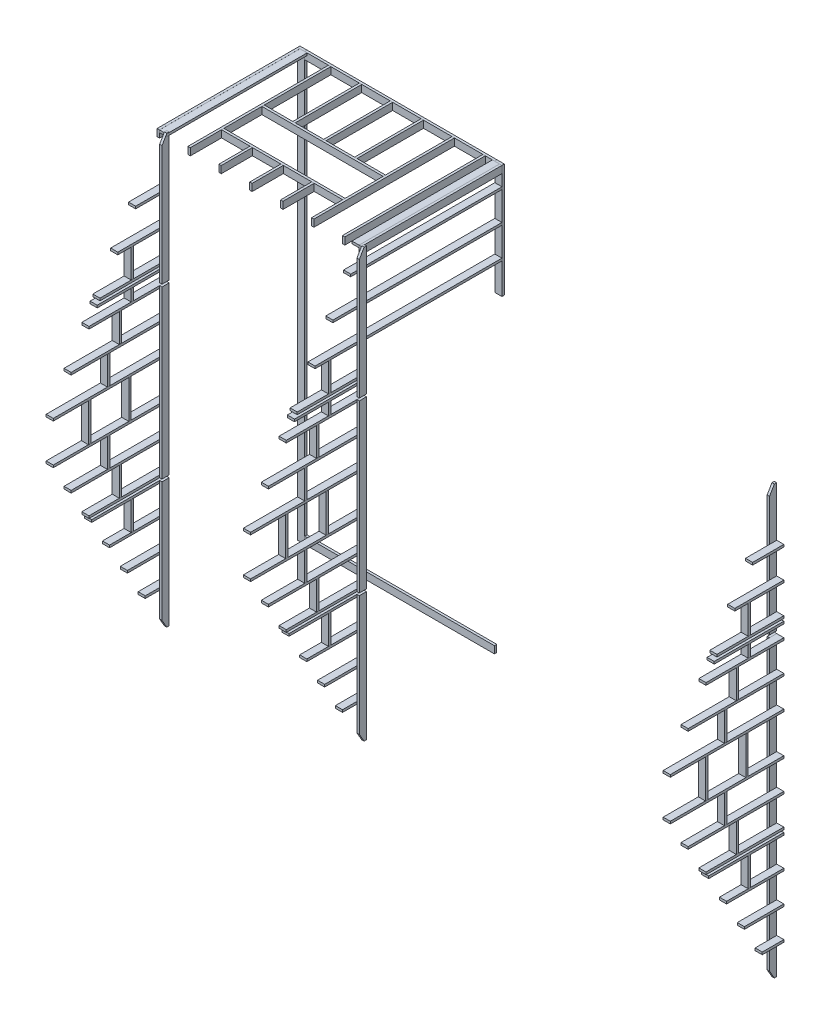
from build123d import *

# Parameters (mm, degrees)
EXTRUDE_1_DEPTH         = 50
EXTRUDE_1_DEPTH_BACK    = 100
SKETCH_2_W              = 1579.978213353
SKETCH_2_H              = 50
EXTRUDE_1_2_DEPTH       = 50
EXTRUDE_1_2_DEPTH_BACK  = 100
SKETCH_2_W_2            = 2388.268590218
EXTRUDE_1_3_DEPTH       = 50
EXTRUDE_1_3_DEPTH_BACK  = 100
EXTRUDE_1_4_DEPTH       = 50
EXTRUDE_1_4_DEPTH_BACK  = 100
SKETCH_2_W_3            = 50
SKETCH_2_H_2            = 798
EXTRUDE_1_5_DEPTH       = 50
EXTRUDE_1_5_DEPTH_BACK  = 100
EXTRUDE_1_6_DEPTH       = 50
EXTRUDE_1_6_DEPTH_BACK  = 100
SKETCH_2_W_4            = 2012.990915245
EXTRUDE_1_7_DEPTH       = 50
EXTRUDE_1_7_DEPTH_BACK  = 100
SKETCH_2_W_5            = 1637.713240271
EXTRUDE_1_8_DEPTH       = 50
EXTRUDE_1_8_DEPTH_BACK  = 100
SKETCH_2_W_6            = 1204.700538379
EXTRUDE_1_9_DEPTH       = 50
EXTRUDE_1_9_DEPTH_BACK  = 100
SKETCH_2_W_7            = 829.422863406
EXTRUDE_1_10_DEPTH      = 50
EXTRUDE_1_10_DEPTH_BACK = 100
SKETCH_2_W_8            = 454.145188433
EXTRUDE_1_11_DEPTH      = 50
EXTRUDE_1_11_DEPTH_BACK = 100
SKETCH_2_H_3            = 598
EXTRUDE_1_12_DEPTH      = 50
EXTRUDE_1_12_DEPTH_BACK = 100
EXTRUDE_1_13_DEPTH      = 50
EXTRUDE_1_13_DEPTH_BACK = 100
EXTRUDE_1_14_DEPTH      = 50
EXTRUDE_1_14_DEPTH_BACK = 100
EXTRUDE_1_15_DEPTH      = 50
EXTRUDE_1_15_DEPTH_BACK = 100
EXTRUDE_1_16_DEPTH      = 50
EXTRUDE_1_16_DEPTH_BACK = 100
EXTRUDE_1_17_DEPTH      = 50
EXTRUDE_1_17_DEPTH_BACK = 100
EXTRUDE_1_18_DEPTH      = 50
EXTRUDE_1_18_DEPTH_BACK = 100
SKETCH_2_W_9            = 1464.508159515
EXTRUDE_1_19_DEPTH      = 50
EXTRUDE_1_19_DEPTH_BACK = 100
SKETCH_2_W_10           = 1406.773132596
EXTRUDE_1_20_DEPTH      = 50
EXTRUDE_1_20_DEPTH_BACK = 100
SKETCH_2_W_11           = 1031.495457622
EXTRUDE_1_21_DEPTH      = 50
EXTRUDE_1_21_DEPTH_BACK = 100
SKETCH_2_H_4            = 248
EXTRUDE_1_22_DEPTH      = 50
EXTRUDE_1_22_DEPTH_BACK = 100
EXTRUDE_1_23_DEPTH      = 50
EXTRUDE_1_23_DEPTH_BACK = 100
SKETCH_2_W_12           = 656.217782649
EXTRUDE_START           = 8880
SKETCH_2_2_W            = 1579.978213353
SKETCH_2_2_H            = 50
EXTRUDE_2_DEPTH         = 150
SKETCH_2_2_W_2          = 2388.268590218
EXTRUDE_2_2_DEPTH       = 150
EXTRUDE_2_3_DEPTH       = 150
SKETCH_2_2_W_3          = 50
SKETCH_2_2_H_2          = 798
EXTRUDE_2_4_DEPTH       = 150
EXTRUDE_2_5_DEPTH       = 150
SKETCH_2_2_W_4          = 2012.990915245
EXTRUDE_2_6_DEPTH       = 150
SKETCH_2_2_W_5          = 1637.713240271
EXTRUDE_2_7_DEPTH       = 150
SKETCH_2_2_W_6          = 1204.700538379
EXTRUDE_2_8_DEPTH       = 150
SKETCH_2_2_W_7          = 829.422863406
EXTRUDE_2_9_DEPTH       = 150
SKETCH_2_2_W_8          = 454.145188433
EXTRUDE_2_10_DEPTH      = 150
SKETCH_2_2_H_3          = 598
EXTRUDE_2_11_DEPTH      = 150
EXTRUDE_2_12_DEPTH      = 150
EXTRUDE_2_13_DEPTH      = 150
EXTRUDE_2_14_DEPTH      = 150
EXTRUDE_2_15_DEPTH      = 150
EXTRUDE_2_16_DEPTH      = 150
EXTRUDE_2_17_DEPTH      = 150
SKETCH_2_2_W_9          = 1464.508159515
EXTRUDE_2_18_DEPTH      = 150
SKETCH_2_2_W_10         = 1406.773132596
EXTRUDE_2_19_DEPTH      = 150
SKETCH_2_2_W_11         = 1031.495457622
EXTRUDE_2_20_DEPTH      = 150
SKETCH_2_2_H_4          = 248
EXTRUDE_2_21_DEPTH      = 150
EXTRUDE_2_22_DEPTH      = 150
SKETCH_2_2_W_12         = 656.217782649
EXTRUDE_2_23_DEPTH      = 150
EXTRUDE_START_2         = 13030
SKETCH_2_3_W            = 1579.978213353
SKETCH_2_3_H            = 50
EXTRUDE_3_DEPTH         = 150
SKETCH_2_3_W_2          = 2388.268590218
EXTRUDE_3_2_DEPTH       = 150
EXTRUDE_3_3_DEPTH       = 150
SKETCH_2_3_W_3          = 50
SKETCH_2_3_H_2          = 798
EXTRUDE_3_4_DEPTH       = 150
EXTRUDE_3_5_DEPTH       = 150
SKETCH_2_3_W_4          = 2012.990915245
EXTRUDE_3_6_DEPTH       = 150
SKETCH_2_3_W_5          = 1637.713240271
EXTRUDE_3_7_DEPTH       = 150
SKETCH_2_3_W_6          = 1204.700538379
EXTRUDE_3_8_DEPTH       = 150
SKETCH_2_3_W_7          = 829.422863406
EXTRUDE_3_9_DEPTH       = 150
SKETCH_2_3_W_8          = 454.145188433
EXTRUDE_3_10_DEPTH      = 150
SKETCH_2_3_H_3          = 598
EXTRUDE_3_11_DEPTH      = 150
EXTRUDE_3_12_DEPTH      = 150
EXTRUDE_3_13_DEPTH      = 150
EXTRUDE_3_14_DEPTH      = 150
EXTRUDE_3_15_DEPTH      = 150
EXTRUDE_3_16_DEPTH      = 150
EXTRUDE_3_17_DEPTH      = 150
SKETCH_2_3_W_9          = 1464.508159515
EXTRUDE_3_18_DEPTH      = 150
SKETCH_2_3_W_10         = 1406.773132596
EXTRUDE_3_19_DEPTH      = 150
SKETCH_2_3_W_11         = 1031.495457622
EXTRUDE_3_20_DEPTH      = 150
SKETCH_2_3_H_4          = 248
EXTRUDE_3_21_DEPTH      = 150
EXTRUDE_3_22_DEPTH      = 150
SKETCH_2_3_W_12         = 656.217782649
EXTRUDE_3_23_DEPTH      = 150
EXTRUDE_4_DEPTH         = 50
SKETCH_3_W              = 150
SKETCH_3_H              = 3500
EXTRUDE_4_2_DEPTH       = 50
EXTRUDE_4_3_DEPTH       = 50
EXTRUDE_START_3         = 8680
EXTRUDE_5_DEPTH         = 50
SKETCH_3_2_W            = 150
SKETCH_3_2_H            = 3500
EXTRUDE_5_2_DEPTH       = 50
EXTRUDE_5_3_DEPTH       = 50
EXTRUDE_START_4         = 12830
EXTRUDE_6_DEPTH         = 50
SKETCH_3_3_W            = 150
SKETCH_3_3_H            = 3500
EXTRUDE_6_2_DEPTH       = 50
EXTRUDE_6_3_DEPTH       = 50
SKETCH_4_W              = 150
SKETCH_4_H              = 2390
EXTRUDE_7_DEPTH         = 50
SKETCH_4_H_2            = 8980
EXTRUDE_7_2_DEPTH       = 50
SKETCH_4_W_2            = 3998
SKETCH_4_H_3            = 150
EXTRUDE_7_3_DEPTH       = 50
SKETCH_4_W_3            = 3989
EXTRUDE_7_4_DEPTH       = 50
SKETCH_5_W              = 2900
SKETCH_5_H              = 50
EXTRUDE_8_DEPTH         = 150
EXTRUDE_8_2_DEPTH       = 150
SKETCH_5_W_2            = 3180.940107676
EXTRUDE_8_3_DEPTH       = 150
SKETCH_6_W              = 2955.773502692
SKETCH_6_H              = 150
EXTRUDE_9_DEPTH         = 50
SKETCH_7_W              = 50
SKETCH_7_H              = 150
EXTRUDE_10_DEPTH        = 2955.773502692
SKETCH_7_W_2            = 150
SKETCH_7_H_2            = 50
EXTRUDE_10_2_DEPTH      = 2955.773502692
EXTRUDE_10_3_DEPTH      = 2955.773502692
EXTRUDE_10_4_DEPTH      = 2955.773502692
EXTRUDE_10_5_DEPTH      = 2955.773502692
EXTRUDE_10_6_DEPTH      = 2955.773502692
EXTRUDE_10_7_DEPTH      = 2955.773502692
EXTRUDE_10_8_DEPTH      = 2955.773502692
EXTRUDE_10_9_DEPTH      = 2955.773502692
SKETCH_8_W              = 2550
SKETCH_8_H              = 900
CUT_EXTRUDE_1_DEPTH     = 488
SKETCH_9_W              = 2550
SKETCH_9_H              = 50
EXTRUDE_11_DEPTH        = 150
EXTRUDE_11_2_DEPTH      = 150


with BuildPart() as part:
    # Эскиз2 → Бобышка-Вытянуть1 (new, two sides: drawn at the far end of the back side and taken through both)
    with BuildSketch(Plane.ZY.offset(110).offset(-EXTRUDE_1_DEPTH_BACK)):
        with Locations((739.989106677, 2675)):
            Rectangle(SKETCH_2_W, SKETCH_2_H)
    extrude(amount=EXTRUDE_1_DEPTH + EXTRUDE_1_DEPTH_BACK)


with BuildPart() as body_2:
    # Эскиз2 → Extrude 1 2 (new, two sides: drawn at the far end of the back side and taken through both)
    with BuildSketch(Plane.ZY.offset(110).offset(-EXTRUDE_1_2_DEPTH_BACK)):
        with Locations((1144.134295109, 4075)):
            Rectangle(SKETCH_2_W_2, SKETCH_2_H)
    extrude(amount=EXTRUDE_1_2_DEPTH + EXTRUDE_1_2_DEPTH_BACK)


with BuildPart() as body_3:
    # Эскиз2 → Extrude 1 3 (new, two sides: drawn at the far end of the back side and taken through both)
    with BuildSketch(Plane.ZY.offset(110).offset(-EXTRUDE_1_3_DEPTH_BACK)):
        with Locations((1144.134295109, 4925)):
            Rectangle(SKETCH_2_W_2, SKETCH_2_H)
    extrude(amount=EXTRUDE_1_3_DEPTH + EXTRUDE_1_3_DEPTH_BACK)


with BuildPart() as body_4:
    # Эскиз2 → Extrude 1 4 (new, two sides: drawn at the far end of the back side and taken through both)
    with BuildSketch(Plane.ZY.offset(110).offset(-EXTRUDE_1_4_DEPTH_BACK)):
        with Locations((1575, 4500)):
            Rectangle(SKETCH_2_W_3, SKETCH_2_H_2)
    extrude(amount=EXTRUDE_1_4_DEPTH + EXTRUDE_1_4_DEPTH_BACK)


with BuildPart() as body_5:
    # Эскиз2 → Extrude 1 5 (new, two sides: drawn at the far end of the back side and taken through both)
    with BuildSketch(Plane.ZY.offset(110).offset(-EXTRUDE_1_5_DEPTH_BACK)):
        with Locations((725, 4500)):
            Rectangle(SKETCH_2_W_3, SKETCH_2_H_2)
    extrude(amount=EXTRUDE_1_5_DEPTH + EXTRUDE_1_5_DEPTH_BACK)


with BuildPart() as body_6:
    # Эскиз2 → Extrude 1 6 (new, two sides: drawn at the far end of the back side and taken through both)
    with BuildSketch(Plane.ZY.offset(110).offset(-EXTRUDE_1_6_DEPTH_BACK)):
        with Locations((956.495457623, 3425)):
            Rectangle(SKETCH_2_W_4, SKETCH_2_H)
    extrude(amount=EXTRUDE_1_6_DEPTH + EXTRUDE_1_6_DEPTH_BACK)


with BuildPart() as body_7:
    # Эскиз2 → Extrude 1 7 (new, two sides: drawn at the far end of the back side and taken through both)
    with BuildSketch(Plane.ZY.offset(110).offset(-EXTRUDE_1_7_DEPTH_BACK)):
        with Locations((768.856620136, 2775)):
            Rectangle(SKETCH_2_W_5, SKETCH_2_H)
    extrude(amount=EXTRUDE_1_7_DEPTH + EXTRUDE_1_7_DEPTH_BACK)


with BuildPart() as body_8:
    # Эскиз2 → Extrude 1 8 (new, two sides: drawn at the far end of the back side and taken through both)
    with BuildSketch(Plane.ZY.offset(110).offset(-EXTRUDE_1_8_DEPTH_BACK)):
        with Locations((552.35026919, 2025)):
            Rectangle(SKETCH_2_W_6, SKETCH_2_H)
    extrude(amount=EXTRUDE_1_8_DEPTH + EXTRUDE_1_8_DEPTH_BACK)


with BuildPart() as body_9:
    # Эскиз2 → Extrude 1 9 (new, two sides: drawn at the far end of the back side and taken through both)
    with BuildSketch(Plane.ZY.offset(110).offset(-EXTRUDE_1_9_DEPTH_BACK)):
        with Locations((364.711431703, 1375)):
            Rectangle(SKETCH_2_W_7, SKETCH_2_H)
    extrude(amount=EXTRUDE_1_9_DEPTH + EXTRUDE_1_9_DEPTH_BACK)


with BuildPart() as body_10:
    # Эскиз2 → Extrude 1 10 (new, two sides: drawn at the far end of the back side and taken through both)
    with BuildSketch(Plane.ZY.offset(110).offset(-EXTRUDE_1_10_DEPTH_BACK)):
        with Locations((177.072594217, 725)):
            Rectangle(SKETCH_2_W_8, SKETCH_2_H)
    extrude(amount=EXTRUDE_1_10_DEPTH + EXTRUDE_1_10_DEPTH_BACK)


with BuildPart() as body_11:
    # Эскиз2 → Extrude 1 11 (new, two sides: drawn at the far end of the back side and taken through both)
    with BuildSketch(Plane.ZY.offset(110).offset(-EXTRUDE_1_11_DEPTH_BACK)):
        with Locations((1175, 3750)):
            Rectangle(SKETCH_2_W_3, SKETCH_2_H_3)
    extrude(amount=EXTRUDE_1_11_DEPTH + EXTRUDE_1_11_DEPTH_BACK)


with BuildPart() as body_12:
    # Эскиз2 → Extrude 1 12 (new, two sides: drawn at the far end of the back side and taken through both)
    with BuildSketch(Plane.ZY.offset(110).offset(-EXTRUDE_1_12_DEPTH_BACK)):
        with Locations((925, 3100)):
            Rectangle(SKETCH_2_W_3, SKETCH_2_H_3)
    extrude(amount=EXTRUDE_1_12_DEPTH + EXTRUDE_1_12_DEPTH_BACK)


with BuildPart() as body_13:
    # Эскиз2 → Extrude 1 13 (new, two sides: drawn at the far end of the back side and taken through both)
    with BuildSketch(Plane.ZY.offset(110).offset(-EXTRUDE_1_13_DEPTH_BACK)):
        with Locations((675, 2350)):
            Rectangle(SKETCH_2_W_3, SKETCH_2_H_3)
    extrude(amount=EXTRUDE_1_13_DEPTH + EXTRUDE_1_13_DEPTH_BACK)


with BuildPart() as body_14:
    # Эскиз2 → Extrude 1 14 (new, two sides: drawn at the far end of the back side and taken through both)
    with BuildSketch(Plane.ZY.offset(110).offset(-EXTRUDE_1_14_DEPTH_BACK)):
        with Locations((1175, 5250)):
            Rectangle(SKETCH_2_W_3, SKETCH_2_H_3)
    extrude(amount=EXTRUDE_1_14_DEPTH + EXTRUDE_1_14_DEPTH_BACK)


with BuildPart() as body_15:
    # Эскиз2 → Extrude 1 15 (new, two sides: drawn at the far end of the back side and taken through both)
    with BuildSketch(Plane.ZY.offset(110).offset(-EXTRUDE_1_15_DEPTH_BACK)):
        with Locations((925, 5900)):
            Rectangle(SKETCH_2_W_3, SKETCH_2_H_3)
    extrude(amount=EXTRUDE_1_15_DEPTH + EXTRUDE_1_15_DEPTH_BACK)


with BuildPart() as body_16:
    # Эскиз2 → Extrude 1 16 (new, two sides: drawn at the far end of the back side and taken through both)
    with BuildSketch(Plane.ZY.offset(110).offset(-EXTRUDE_1_16_DEPTH_BACK)):
        with Locations((768.856620136, 6225)):
            Rectangle(SKETCH_2_W_5, SKETCH_2_H)
    extrude(amount=EXTRUDE_1_16_DEPTH + EXTRUDE_1_16_DEPTH_BACK)


with BuildPart() as body_17:
    # Эскиз2 → Extrude 1 17 (new, two sides: drawn at the far end of the back side and taken through both)
    with BuildSketch(Plane.ZY.offset(110).offset(-EXTRUDE_1_17_DEPTH_BACK)):
        with Locations((956.495457623, 5575)):
            Rectangle(SKETCH_2_W_4, SKETCH_2_H)
    extrude(amount=EXTRUDE_1_17_DEPTH + EXTRUDE_1_17_DEPTH_BACK)


with BuildPart() as body_18:
    # Эскиз2 → Extrude 1 18 (new, two sides: drawn at the far end of the back side and taken through both)
    with BuildSketch(Plane.ZY.offset(110).offset(-EXTRUDE_1_18_DEPTH_BACK)):
        with Locations((682.254079757, 6525)):
            Rectangle(SKETCH_2_W_9, SKETCH_2_H)
    extrude(amount=EXTRUDE_1_18_DEPTH + EXTRUDE_1_18_DEPTH_BACK)


with BuildPart() as body_19:
    # Эскиз2 → Extrude 1 19 (new, two sides: drawn at the far end of the back side and taken through both)
    with BuildSketch(Plane.ZY.offset(110).offset(-EXTRUDE_1_19_DEPTH_BACK)):
        with Locations((653.386566298, 6625)):
            Rectangle(SKETCH_2_W_10, SKETCH_2_H)
    extrude(amount=EXTRUDE_1_19_DEPTH + EXTRUDE_1_19_DEPTH_BACK)


with BuildPart() as body_20:
    # Эскиз2 → Extrude 1 20 (new, two sides: drawn at the far end of the back side and taken through both)
    with BuildSketch(Plane.ZY.offset(110).offset(-EXTRUDE_1_20_DEPTH_BACK)):
        with Locations((465.747728811, 7275)):
            Rectangle(SKETCH_2_W_11, SKETCH_2_H)
    extrude(amount=EXTRUDE_1_20_DEPTH + EXTRUDE_1_20_DEPTH_BACK)


with BuildPart() as body_21:
    # Эскиз2 → Extrude 1 21 (new, two sides: drawn at the far end of the back side and taken through both)
    with BuildSketch(Plane.ZY.offset(110).offset(-EXTRUDE_1_21_DEPTH_BACK)):
        with Locations((675, 6375)):
            Rectangle(SKETCH_2_W_3, SKETCH_2_H_4)
    extrude(amount=EXTRUDE_1_21_DEPTH + EXTRUDE_1_21_DEPTH_BACK)


with BuildPart() as body_22:
    # Эскиз2 → Extrude 1 22 (new, two sides: drawn at the far end of the back side and taken through both)
    with BuildSketch(Plane.ZY.offset(110).offset(-EXTRUDE_1_22_DEPTH_BACK)):
        with Locations((675, 6950)):
            Rectangle(SKETCH_2_W_3, SKETCH_2_H_3)
    extrude(amount=EXTRUDE_1_22_DEPTH + EXTRUDE_1_22_DEPTH_BACK)


with BuildPart() as body_23:
    # Эскиз2 → Extrude 1 23 (new, two sides: drawn at the far end of the back side and taken through both)
    with BuildSketch(Plane.ZY.offset(110).offset(-EXTRUDE_1_23_DEPTH_BACK)):
        with Locations((278.108891325, 7925)):
            Rectangle(SKETCH_2_W_12, SKETCH_2_H)
    extrude(amount=EXTRUDE_1_23_DEPTH + EXTRUDE_1_23_DEPTH_BACK)


with BuildPart() as body_24:
    # Эскиз2<2> → Бобышка-Вытянуть2 (new body)
    with BuildSketch(Plane.ZY.offset(110).offset(EXTRUDE_START)):
        with Locations((739.989106677, 2675)):
            Rectangle(SKETCH_2_2_W, SKETCH_2_2_H)
    extrude(amount=-EXTRUDE_2_DEPTH)


with BuildPart() as body_25:
    # Эскиз2<2> → Extrude 2 2 (new body)
    with BuildSketch(Plane.ZY.offset(110).offset(EXTRUDE_START)):
        with Locations((1144.134295109, 4075)):
            Rectangle(SKETCH_2_2_W_2, SKETCH_2_2_H)
    extrude(amount=-EXTRUDE_2_2_DEPTH)


with BuildPart() as body_26:
    # Эскиз2<2> → Extrude 2 3 (new body)
    with BuildSketch(Plane.ZY.offset(110).offset(EXTRUDE_START)):
        with Locations((1144.134295109, 4925)):
            Rectangle(SKETCH_2_2_W_2, SKETCH_2_2_H)
    extrude(amount=-EXTRUDE_2_3_DEPTH)


with BuildPart() as body_27:
    # Эскиз2<2> → Extrude 2 4 (new body)
    with BuildSketch(Plane.ZY.offset(110).offset(EXTRUDE_START)):
        with Locations((1575, 4500)):
            Rectangle(SKETCH_2_2_W_3, SKETCH_2_2_H_2)
    extrude(amount=-EXTRUDE_2_4_DEPTH)


with BuildPart() as body_28:
    # Эскиз2<2> → Extrude 2 5 (new body)
    with BuildSketch(Plane.ZY.offset(110).offset(EXTRUDE_START)):
        with Locations((725, 4500)):
            Rectangle(SKETCH_2_2_W_3, SKETCH_2_2_H_2)
    extrude(amount=-EXTRUDE_2_5_DEPTH)


with BuildPart() as body_29:
    # Эскиз2<2> → Extrude 2 6 (new body)
    with BuildSketch(Plane.ZY.offset(110).offset(EXTRUDE_START)):
        with Locations((956.495457623, 3425)):
            Rectangle(SKETCH_2_2_W_4, SKETCH_2_2_H)
    extrude(amount=-EXTRUDE_2_6_DEPTH)


with BuildPart() as body_30:
    # Эскиз2<2> → Extrude 2 7 (new body)
    with BuildSketch(Plane.ZY.offset(110).offset(EXTRUDE_START)):
        with Locations((768.856620136, 2775)):
            Rectangle(SKETCH_2_2_W_5, SKETCH_2_2_H)
    extrude(amount=-EXTRUDE_2_7_DEPTH)


with BuildPart() as body_31:
    # Эскиз2<2> → Extrude 2 8 (new body)
    with BuildSketch(Plane.ZY.offset(110).offset(EXTRUDE_START)):
        with Locations((552.35026919, 2025)):
            Rectangle(SKETCH_2_2_W_6, SKETCH_2_2_H)
    extrude(amount=-EXTRUDE_2_8_DEPTH)


with BuildPart() as body_32:
    # Эскиз2<2> → Extrude 2 9 (new body)
    with BuildSketch(Plane.ZY.offset(110).offset(EXTRUDE_START)):
        with Locations((364.711431703, 1375)):
            Rectangle(SKETCH_2_2_W_7, SKETCH_2_2_H)
    extrude(amount=-EXTRUDE_2_9_DEPTH)


with BuildPart() as body_33:
    # Эскиз2<2> → Extrude 2 10 (new body)
    with BuildSketch(Plane.ZY.offset(110).offset(EXTRUDE_START)):
        with Locations((177.072594217, 725)):
            Rectangle(SKETCH_2_2_W_8, SKETCH_2_2_H)
    extrude(amount=-EXTRUDE_2_10_DEPTH)


with BuildPart() as body_34:
    # Эскиз2<2> → Extrude 2 11 (new body)
    with BuildSketch(Plane.ZY.offset(110).offset(EXTRUDE_START)):
        with Locations((1175, 3750)):
            Rectangle(SKETCH_2_2_W_3, SKETCH_2_2_H_3)
    extrude(amount=-EXTRUDE_2_11_DEPTH)


with BuildPart() as body_35:
    # Эскиз2<2> → Extrude 2 12 (new body)
    with BuildSketch(Plane.ZY.offset(110).offset(EXTRUDE_START)):
        with Locations((925, 3100)):
            Rectangle(SKETCH_2_2_W_3, SKETCH_2_2_H_3)
    extrude(amount=-EXTRUDE_2_12_DEPTH)


with BuildPart() as body_36:
    # Эскиз2<2> → Extrude 2 13 (new body)
    with BuildSketch(Plane.ZY.offset(110).offset(EXTRUDE_START)):
        with Locations((675, 2350)):
            Rectangle(SKETCH_2_2_W_3, SKETCH_2_2_H_3)
    extrude(amount=-EXTRUDE_2_13_DEPTH)


with BuildPart() as body_37:
    # Эскиз2<2> → Extrude 2 14 (new body)
    with BuildSketch(Plane.ZY.offset(110).offset(EXTRUDE_START)):
        with Locations((1175, 5250)):
            Rectangle(SKETCH_2_2_W_3, SKETCH_2_2_H_3)
    extrude(amount=-EXTRUDE_2_14_DEPTH)


with BuildPart() as body_38:
    # Эскиз2<2> → Extrude 2 15 (new body)
    with BuildSketch(Plane.ZY.offset(110).offset(EXTRUDE_START)):
        with Locations((925, 5900)):
            Rectangle(SKETCH_2_2_W_3, SKETCH_2_2_H_3)
    extrude(amount=-EXTRUDE_2_15_DEPTH)


with BuildPart() as body_39:
    # Эскиз2<2> → Extrude 2 16 (new body)
    with BuildSketch(Plane.ZY.offset(110).offset(EXTRUDE_START)):
        with Locations((768.856620136, 6225)):
            Rectangle(SKETCH_2_2_W_5, SKETCH_2_2_H)
    extrude(amount=-EXTRUDE_2_16_DEPTH)


with BuildPart() as body_40:
    # Эскиз2<2> → Extrude 2 17 (new body)
    with BuildSketch(Plane.ZY.offset(110).offset(EXTRUDE_START)):
        with Locations((956.495457623, 5575)):
            Rectangle(SKETCH_2_2_W_4, SKETCH_2_2_H)
    extrude(amount=-EXTRUDE_2_17_DEPTH)


with BuildPart() as body_41:
    # Эскиз2<2> → Extrude 2 18 (new body)
    with BuildSketch(Plane.ZY.offset(110).offset(EXTRUDE_START)):
        with Locations((682.254079757, 6525)):
            Rectangle(SKETCH_2_2_W_9, SKETCH_2_2_H)
    extrude(amount=-EXTRUDE_2_18_DEPTH)


with BuildPart() as body_42:
    # Эскиз2<2> → Extrude 2 19 (new body)
    with BuildSketch(Plane.ZY.offset(110).offset(EXTRUDE_START)):
        with Locations((653.386566298, 6625)):
            Rectangle(SKETCH_2_2_W_10, SKETCH_2_2_H)
    extrude(amount=-EXTRUDE_2_19_DEPTH)


with BuildPart() as body_43:
    # Эскиз2<2> → Extrude 2 20 (new body)
    with BuildSketch(Plane.ZY.offset(110).offset(EXTRUDE_START)):
        with Locations((465.747728811, 7275)):
            Rectangle(SKETCH_2_2_W_11, SKETCH_2_2_H)
    extrude(amount=-EXTRUDE_2_20_DEPTH)


with BuildPart() as body_44:
    # Эскиз2<2> → Extrude 2 21 (new body)
    with BuildSketch(Plane.ZY.offset(110).offset(EXTRUDE_START)):
        with Locations((675, 6375)):
            Rectangle(SKETCH_2_2_W_3, SKETCH_2_2_H_4)
    extrude(amount=-EXTRUDE_2_21_DEPTH)


with BuildPart() as body_45:
    # Эскиз2<2> → Extrude 2 22 (new body)
    with BuildSketch(Plane.ZY.offset(110).offset(EXTRUDE_START)):
        with Locations((675, 6950)):
            Rectangle(SKETCH_2_2_W_3, SKETCH_2_2_H_3)
    extrude(amount=-EXTRUDE_2_22_DEPTH)


with BuildPart() as body_46:
    # Эскиз2<2> → Extrude 2 23 (new body)
    with BuildSketch(Plane.ZY.offset(110).offset(EXTRUDE_START)):
        with Locations((278.108891325, 7925)):
            Rectangle(SKETCH_2_2_W_12, SKETCH_2_2_H)
    extrude(amount=-EXTRUDE_2_23_DEPTH)


with BuildPart() as body_47:
    # Эскиз2<3> → Бобышка-Вытянуть3 (new body)
    with BuildSketch(Plane.ZY.offset(110).offset(EXTRUDE_START_2)):
        with Locations((739.989106677, 2675)):
            Rectangle(SKETCH_2_3_W, SKETCH_2_3_H)
    extrude(amount=-EXTRUDE_3_DEPTH)


with BuildPart() as body_48:
    # Эскиз2<3> → Extrude 3 2 (new body)
    with BuildSketch(Plane.ZY.offset(110).offset(EXTRUDE_START_2)):
        with Locations((1144.134295109, 4075)):
            Rectangle(SKETCH_2_3_W_2, SKETCH_2_3_H)
    extrude(amount=-EXTRUDE_3_2_DEPTH)


with BuildPart() as body_49:
    # Эскиз2<3> → Extrude 3 3 (new body)
    with BuildSketch(Plane.ZY.offset(110).offset(EXTRUDE_START_2)):
        with Locations((1144.134295109, 4925)):
            Rectangle(SKETCH_2_3_W_2, SKETCH_2_3_H)
    extrude(amount=-EXTRUDE_3_3_DEPTH)


with BuildPart() as body_50:
    # Эскиз2<3> → Extrude 3 4 (new body)
    with BuildSketch(Plane.ZY.offset(110).offset(EXTRUDE_START_2)):
        with Locations((1575, 4500)):
            Rectangle(SKETCH_2_3_W_3, SKETCH_2_3_H_2)
    extrude(amount=-EXTRUDE_3_4_DEPTH)


with BuildPart() as body_51:
    # Эскиз2<3> → Extrude 3 5 (new body)
    with BuildSketch(Plane.ZY.offset(110).offset(EXTRUDE_START_2)):
        with Locations((725, 4500)):
            Rectangle(SKETCH_2_3_W_3, SKETCH_2_3_H_2)
    extrude(amount=-EXTRUDE_3_5_DEPTH)


with BuildPart() as body_52:
    # Эскиз2<3> → Extrude 3 6 (new body)
    with BuildSketch(Plane.ZY.offset(110).offset(EXTRUDE_START_2)):
        with Locations((956.495457623, 3425)):
            Rectangle(SKETCH_2_3_W_4, SKETCH_2_3_H)
    extrude(amount=-EXTRUDE_3_6_DEPTH)


with BuildPart() as body_53:
    # Эскиз2<3> → Extrude 3 7 (new body)
    with BuildSketch(Plane.ZY.offset(110).offset(EXTRUDE_START_2)):
        with Locations((768.856620136, 2775)):
            Rectangle(SKETCH_2_3_W_5, SKETCH_2_3_H)
    extrude(amount=-EXTRUDE_3_7_DEPTH)


with BuildPart() as body_54:
    # Эскиз2<3> → Extrude 3 8 (new body)
    with BuildSketch(Plane.ZY.offset(110).offset(EXTRUDE_START_2)):
        with Locations((552.35026919, 2025)):
            Rectangle(SKETCH_2_3_W_6, SKETCH_2_3_H)
    extrude(amount=-EXTRUDE_3_8_DEPTH)


with BuildPart() as body_55:
    # Эскиз2<3> → Extrude 3 9 (new body)
    with BuildSketch(Plane.ZY.offset(110).offset(EXTRUDE_START_2)):
        with Locations((364.711431703, 1375)):
            Rectangle(SKETCH_2_3_W_7, SKETCH_2_3_H)
    extrude(amount=-EXTRUDE_3_9_DEPTH)


with BuildPart() as body_56:
    # Эскиз2<3> → Extrude 3 10 (new body)
    with BuildSketch(Plane.ZY.offset(110).offset(EXTRUDE_START_2)):
        with Locations((177.072594217, 725)):
            Rectangle(SKETCH_2_3_W_8, SKETCH_2_3_H)
    extrude(amount=-EXTRUDE_3_10_DEPTH)


with BuildPart() as body_57:
    # Эскиз2<3> → Extrude 3 11 (new body)
    with BuildSketch(Plane.ZY.offset(110).offset(EXTRUDE_START_2)):
        with Locations((1175, 3750)):
            Rectangle(SKETCH_2_3_W_3, SKETCH_2_3_H_3)
    extrude(amount=-EXTRUDE_3_11_DEPTH)


with BuildPart() as body_58:
    # Эскиз2<3> → Extrude 3 12 (new body)
    with BuildSketch(Plane.ZY.offset(110).offset(EXTRUDE_START_2)):
        with Locations((925, 3100)):
            Rectangle(SKETCH_2_3_W_3, SKETCH_2_3_H_3)
    extrude(amount=-EXTRUDE_3_12_DEPTH)


with BuildPart() as body_59:
    # Эскиз2<3> → Extrude 3 13 (new body)
    with BuildSketch(Plane.ZY.offset(110).offset(EXTRUDE_START_2)):
        with Locations((675, 2350)):
            Rectangle(SKETCH_2_3_W_3, SKETCH_2_3_H_3)
    extrude(amount=-EXTRUDE_3_13_DEPTH)


with BuildPart() as body_60:
    # Эскиз2<3> → Extrude 3 14 (new body)
    with BuildSketch(Plane.ZY.offset(110).offset(EXTRUDE_START_2)):
        with Locations((1175, 5250)):
            Rectangle(SKETCH_2_3_W_3, SKETCH_2_3_H_3)
    extrude(amount=-EXTRUDE_3_14_DEPTH)


with BuildPart() as body_61:
    # Эскиз2<3> → Extrude 3 15 (new body)
    with BuildSketch(Plane.ZY.offset(110).offset(EXTRUDE_START_2)):
        with Locations((925, 5900)):
            Rectangle(SKETCH_2_3_W_3, SKETCH_2_3_H_3)
    extrude(amount=-EXTRUDE_3_15_DEPTH)


with BuildPart() as body_62:
    # Эскиз2<3> → Extrude 3 16 (new body)
    with BuildSketch(Plane.ZY.offset(110).offset(EXTRUDE_START_2)):
        with Locations((768.856620136, 6225)):
            Rectangle(SKETCH_2_3_W_5, SKETCH_2_3_H)
    extrude(amount=-EXTRUDE_3_16_DEPTH)


with BuildPart() as body_63:
    # Эскиз2<3> → Extrude 3 17 (new body)
    with BuildSketch(Plane.ZY.offset(110).offset(EXTRUDE_START_2)):
        with Locations((956.495457623, 5575)):
            Rectangle(SKETCH_2_3_W_4, SKETCH_2_3_H)
    extrude(amount=-EXTRUDE_3_17_DEPTH)


with BuildPart() as body_64:
    # Эскиз2<3> → Extrude 3 18 (new body)
    with BuildSketch(Plane.ZY.offset(110).offset(EXTRUDE_START_2)):
        with Locations((682.254079757, 6525)):
            Rectangle(SKETCH_2_3_W_9, SKETCH_2_3_H)
    extrude(amount=-EXTRUDE_3_18_DEPTH)


with BuildPart() as body_65:
    # Эскиз2<3> → Extrude 3 19 (new body)
    with BuildSketch(Plane.ZY.offset(110).offset(EXTRUDE_START_2)):
        with Locations((653.386566298, 6625)):
            Rectangle(SKETCH_2_3_W_10, SKETCH_2_3_H)
    extrude(amount=-EXTRUDE_3_19_DEPTH)


with BuildPart() as body_66:
    # Эскиз2<3> → Extrude 3 20 (new body)
    with BuildSketch(Plane.ZY.offset(110).offset(EXTRUDE_START_2)):
        with Locations((465.747728811, 7275)):
            Rectangle(SKETCH_2_3_W_11, SKETCH_2_3_H)
    extrude(amount=-EXTRUDE_3_20_DEPTH)


with BuildPart() as body_67:
    # Эскиз2<3> → Extrude 3 21 (new body)
    with BuildSketch(Plane.ZY.offset(110).offset(EXTRUDE_START_2)):
        with Locations((675, 6375)):
            Rectangle(SKETCH_2_3_W_3, SKETCH_2_3_H_4)
    extrude(amount=-EXTRUDE_3_21_DEPTH)


with BuildPart() as body_68:
    # Эскиз2<3> → Extrude 3 22 (new body)
    with BuildSketch(Plane.ZY.offset(110).offset(EXTRUDE_START_2)):
        with Locations((675, 6950)):
            Rectangle(SKETCH_2_3_W_3, SKETCH_2_3_H_3)
    extrude(amount=-EXTRUDE_3_22_DEPTH)


with BuildPart() as body_69:
    # Эскиз2<3> → Extrude 3 23 (new body)
    with BuildSketch(Plane.ZY.offset(110).offset(EXTRUDE_START_2)):
        with Locations((278.108891325, 7925)):
            Rectangle(SKETCH_2_3_W_12, SKETCH_2_3_H)
    extrude(amount=-EXTRUDE_3_23_DEPTH)


with BuildPart() as body_70:
    # Эскиз3 → Бобышка-Вытянуть4 (new body)
    with BuildSketch(Plane.ZY.offset(160)):
        Polygon((0, 0), (100, 173.205080757), (100, 2700), (-50, 2700), (-50, 0), align=None)
    extrude(amount=EXTRUDE_4_DEPTH)


with BuildPart() as body_71:
    # Эскиз3 → Extrude 4 2 (new body)
    with BuildSketch(Plane.ZY.offset(160)):
        with Locations((25, 4500)):
            Rectangle(SKETCH_3_W, SKETCH_3_H)
    extrude(amount=EXTRUDE_4_2_DEPTH)


with BuildPart() as body_72:
    # Эскиз3 → Extrude 4 3 (new body)
    with BuildSketch(Plane.ZY.offset(160)):
        Polygon((-50, 6300), (100, 6300), (100, 8826.794919243), (0, 9000), (-50, 9000), align=None)
    extrude(amount=EXTRUDE_4_3_DEPTH)


with BuildPart() as body_73:
    # Эскиз3<2> → Бобышка-Вытянуть5 (new body)
    with BuildSketch(Plane.ZY.offset(160).offset(EXTRUDE_START_3)):
        Polygon((0, 0), (100, 173.205080757), (100, 2700), (-50, 2700), (-50, 0), align=None)
    extrude(amount=-EXTRUDE_5_DEPTH)


with BuildPart() as body_74:
    # Эскиз3<2> → Extrude 5 2 (new body)
    with BuildSketch(Plane.ZY.offset(160).offset(EXTRUDE_START_3)):
        with Locations((25, 4500)):
            Rectangle(SKETCH_3_2_W, SKETCH_3_2_H)
    extrude(amount=-EXTRUDE_5_2_DEPTH)


with BuildPart() as body_75:
    # Эскиз3<2> → Extrude 5 3 (new body)
    with BuildSketch(Plane.ZY.offset(160).offset(EXTRUDE_START_3)):
        Polygon((-50, 6300), (100, 6300), (100, 8826.794919243), (0, 9000), (-50, 9000), align=None)
    extrude(amount=-EXTRUDE_5_3_DEPTH)


with BuildPart() as body_76:
    # Эскиз3<3> → Бобышка-Вытянуть6 (new body)
    with BuildSketch(Plane.ZY.offset(160).offset(EXTRUDE_START_4)):
        Polygon((0, 0), (100, 173.205080757), (100, 2700), (-50, 2700), (-50, 0), align=None)
    extrude(amount=-EXTRUDE_6_DEPTH)


with BuildPart() as body_77:
    # Эскиз3<3> → Extrude 6 2 (new body)
    with BuildSketch(Plane.ZY.offset(160).offset(EXTRUDE_START_4)):
        with Locations((25, 4500)):
            Rectangle(SKETCH_3_3_W, SKETCH_3_3_H)
    extrude(amount=-EXTRUDE_6_2_DEPTH)


with BuildPart() as body_78:
    # Эскиз3<3> → Extrude 6 3 (new body)
    with BuildSketch(Plane.ZY.offset(160).offset(EXTRUDE_START_4)):
        Polygon((-50, 6300), (100, 6300), (100, 8826.794919243), (0, 9000), (-50, 9000), align=None)
    extrude(amount=-EXTRUDE_6_3_DEPTH)


with BuildPart() as body_79:
    # Эскиз4 → Бобышка-Вытянуть7 (new body)
    with BuildSketch(Plane(origin=(0, 0, -3000), x_dir=(-1, 0, 0), z_dir=(0, 0, -1))):
        with Locations((8915, 7795)):
            Rectangle(SKETCH_4_W, SKETCH_4_H)
    extrude(amount=-EXTRUDE_7_DEPTH)


with BuildPart() as body_80:
    # Эскиз4 → Extrude 7 2 (new body)
    with BuildSketch(Plane(origin=(0, 0, -3000), x_dir=(-1, 0, 0), z_dir=(0, 0, -1))):
        with Locations((13065, 4500)):
            Rectangle(SKETCH_4_W, SKETCH_4_H_2)
    extrude(amount=-EXTRUDE_7_2_DEPTH)


with BuildPart() as body_81:
    # Эскиз4 → Extrude 7 3 (new body)
    with BuildSketch(Plane(origin=(0, 0, -3000), x_dir=(-1, 0, 0), z_dir=(0, 0, -1))):
        with Locations((10990, 8915)):
            Rectangle(SKETCH_4_W_2, SKETCH_4_H_3)
    extrude(amount=-EXTRUDE_7_3_DEPTH)


with BuildPart() as body_82:
    # Эскиз4 → Extrude 7 4 (new body)
    with BuildSketch(Plane(origin=(0, 0, -3000), x_dir=(-1, 0, 0), z_dir=(0, 0, -1))):
        with Locations((10994.5, 85)):
            Rectangle(SKETCH_4_W_3, SKETCH_4_H_3)
    extrude(amount=-EXTRUDE_7_4_DEPTH)


with BuildPart() as body_83:
    # Эскиз5 → Бобышка-Вытянуть8 (new body)
    with BuildSketch(Plane.ZY.offset(8990)):
        with Locations((-1500, 7275)):
            Rectangle(SKETCH_5_W, SKETCH_5_H)
    extrude(amount=-EXTRUDE_8_DEPTH)


with BuildPart() as body_84:
    # Эскиз5 → Extrude 8 2 (new body)
    with BuildSketch(Plane.ZY.offset(8990)):
        with Locations((-1500, 7925)):
            Rectangle(SKETCH_5_W, SKETCH_5_H)
    extrude(amount=-EXTRUDE_8_2_DEPTH)


with BuildPart() as body_85:
    # Эскиз5 → Extrude 8 3 (new body)
    with BuildSketch(Plane.ZY.offset(8990)):
        with Locations((-1359.529946162, 8575)):
            Rectangle(SKETCH_5_W_2, SKETCH_5_H)
    extrude(amount=-EXTRUDE_8_3_DEPTH)


with BuildPart() as body_86:
    # Эскиз6 → Бобышка-Вытянуть9 (new body)
    with BuildSketch(Plane.ZY.offset(8840)):
        with Locations((-1472.113248654, 8915)):
            Rectangle(SKETCH_6_W, SKETCH_6_H)
    extrude(amount=EXTRUDE_9_DEPTH)


with BuildPart() as body_87:
    # Эскиз7 → Бобышка-Вытянуть10 (new body)
    with BuildSketch(Plane.XY.offset(-2950)):
        with Locations((-13115, 8915)):
            Rectangle(SKETCH_7_W, SKETCH_7_H)
    extrude(amount=EXTRUDE_10_DEPTH)


with BuildPart() as body_88:
    # Эскиз7 → Extrude 10 2 (new body)
    with BuildSketch(Plane.XY.offset(-2950)):
        with Locations((-13014, 8965)):
            Rectangle(SKETCH_7_W_2, SKETCH_7_H_2)
    extrude(amount=EXTRUDE_10_2_DEPTH)


with BuildPart() as body_89:
    # Эскиз7 → Extrude 10 3 (new body)
    with BuildSketch(Plane.XY.offset(-2950)):
        with Locations((-8965, 8965)):
            Rectangle(SKETCH_7_W_2, SKETCH_7_H_2)
    extrude(amount=EXTRUDE_10_3_DEPTH)


with BuildPart() as body_90:
    # Эскиз7 → Extrude 10 4 (new body)
    with BuildSketch(Plane.XY.offset(-2950)):
        with Locations((-12465, 8915)):
            Rectangle(SKETCH_7_W, SKETCH_7_H)
    extrude(amount=EXTRUDE_10_4_DEPTH)


with BuildPart() as body_91:
    # Эскиз7 → Extrude 10 5 (new body)
    with BuildSketch(Plane.XY.offset(-2950)):
        with Locations((-11815, 8915)):
            Rectangle(SKETCH_7_W, SKETCH_7_H)
    extrude(amount=EXTRUDE_10_5_DEPTH)


with BuildPart() as body_92:
    # Эскиз7 → Extrude 10 6 (new body)
    with BuildSketch(Plane.XY.offset(-2950)):
        with Locations((-11165, 8915)):
            Rectangle(SKETCH_7_W, SKETCH_7_H)
    extrude(amount=EXTRUDE_10_6_DEPTH)


with BuildPart() as body_93:
    # Эскиз7 → Extrude 10 7 (new body)
    with BuildSketch(Plane.XY.offset(-2950)):
        with Locations((-10515, 8915)):
            Rectangle(SKETCH_7_W, SKETCH_7_H)
    extrude(amount=EXTRUDE_10_7_DEPTH)


with BuildPart() as body_94:
    # Эскиз7 → Extrude 10 8 (new body)
    with BuildSketch(Plane.XY.offset(-2950)):
        with Locations((-9865, 8915)):
            Rectangle(SKETCH_7_W, SKETCH_7_H)
    extrude(amount=EXTRUDE_10_8_DEPTH)


with BuildPart() as body_95:
    # Эскиз7 → Extrude 10 9 (new body)
    with BuildSketch(Plane.XY.offset(-2950)):
        with Locations((-9215, 8915)):
            Rectangle(SKETCH_7_W, SKETCH_7_H)
    extrude(amount=EXTRUDE_10_9_DEPTH)


with BuildPart() as cut_extrude_1_tool:
    # Эскиз8 → Вырез-Вытянуть1 (new body)
    with BuildSketch(Plane(origin=(0, 9000, 0), x_dir=(1, 0, 0), z_dir=(0, 1, 0))):
        with Locations((-11165, 1100)):
            Rectangle(SKETCH_8_W, SKETCH_8_H)
    extrude(amount=-CUT_EXTRUDE_1_DEPTH)


with BuildPart() as body_91_1:
    add(body_91.part)

    # Вырез-Вытянуть1: cut by cut_extrude_1_tool
    add(cut_extrude_1_tool.part, mode=Mode.SUBTRACT)


with BuildPart() as body_92_1:
    add(body_92.part)

    # Вырез-Вытянуть1: cut by cut_extrude_1_tool
    add(cut_extrude_1_tool.part, mode=Mode.SUBTRACT)


with BuildPart() as body_93_1:
    add(body_93.part)

    # Вырез-Вытянуть1: cut by cut_extrude_1_tool
    add(cut_extrude_1_tool.part, mode=Mode.SUBTRACT)


with BuildPart() as cut_extrude_1_piece_1:
    # of the separate pieces the step leaves, piece 1, a body of its own (cut_extrude_1_pieces)
    add(body_91_1.part.solids().sort_by_distance((-11840, 8990, -2950))[0])


with BuildPart() as cut_extrude_1_piece_2:
    # of the separate pieces the step leaves, piece 2, a body of its own (cut_extrude_1_pieces)
    add(body_91_1.part.solids().sort_by_distance((-11790, 8990, -650))[0])


with BuildPart() as cut_extrude_1_piece_1_of_body_92:
    # of the separate pieces the step leaves, piece 1, a body of its own (cut_extrude_1_pieces_of_body_92)
    add(body_92_1.part.solids().sort_by_distance((-11190, 8990, -2950))[0])


with BuildPart() as cut_extrude_1_piece_2_of_body_92:
    # of the separate pieces the step leaves, piece 2, a body of its own (cut_extrude_1_pieces_of_body_92)
    add(body_92_1.part.solids().sort_by_distance((-11140, 8990, -650))[0])


with BuildPart() as cut_extrude_1_piece_1_of_body_93:
    # of the separate pieces the step leaves, piece 1, a body of its own (cut_extrude_1_pieces_of_body_93)
    add(body_93_1.part.solids().sort_by_distance((-10540, 8990, -2950))[0])


with BuildPart() as cut_extrude_1_piece_2_of_body_93:
    # of the separate pieces the step leaves, piece 2, a body of its own (cut_extrude_1_pieces_of_body_93)
    add(body_93_1.part.solids().sort_by_distance((-10490, 8990, -650))[0])


with BuildPart() as body_99:
    # Эскиз9 → Бобышка-Вытянуть11 (new body)
    with BuildSketch(Plane.XZ.offset(-8840)):
        with Locations((-11165, -675)):
            Rectangle(SKETCH_9_W, SKETCH_9_H)
    extrude(amount=-EXTRUDE_11_DEPTH)


with BuildPart() as body_100:
    # Эскиз9 → Extrude 11 2 (new body)
    with BuildSketch(Plane.XZ.offset(-8840)):
        with Locations((-11165, -1525)):
            Rectangle(SKETCH_9_W, SKETCH_9_H)
    extrude(amount=-EXTRUDE_11_2_DEPTH)


solid = Compound([part.part, body_2.part, body_3.part, body_4.part, body_5.part, body_6.part, body_7.part, body_8.part, body_9.part, body_10.part, body_11.part, body_12.part, body_13.part, body_14.part, body_15.part, body_16.part, body_17.part, body_18.part, body_19.part, body_20.part, body_21.part, body_22.part, body_23.part, body_24.part, body_25.part, body_26.part, body_27.part, body_28.part, body_29.part, body_30.part, body_31.part, body_32.part, body_33.part, body_34.part, body_35.part, body_36.part, body_37.part, body_38.part, body_39.part, body_40.part, body_41.part, body_42.part, body_43.part, body_44.part, body_45.part, body_46.part, body_47.part, body_48.part, body_49.part, body_50.part, body_51.part, body_52.part, body_53.part, body_54.part, body_55.part, body_56.part, body_57.part, body_58.part, body_59.part, body_60.part, body_61.part, body_62.part, body_63.part, body_64.part, body_65.part, body_66.part, body_67.part, body_68.part, body_69.part, body_70.part, body_71.part, body_72.part, body_73.part, body_74.part, body_75.part, body_76.part, body_77.part, body_78.part, body_79.part, body_80.part, body_81.part, body_82.part, body_83.part, body_84.part, body_85.part, body_86.part, body_87.part, body_88.part, body_89.part, body_90.part, body_94.part, body_95.part, cut_extrude_1_piece_1.part, cut_extrude_1_piece_2.part, cut_extrude_1_piece_1_of_body_92.part, cut_extrude_1_piece_2_of_body_92.part, cut_extrude_1_piece_1_of_body_93.part, cut_extrude_1_piece_2_of_body_93.part, body_99.part, body_100.part])
